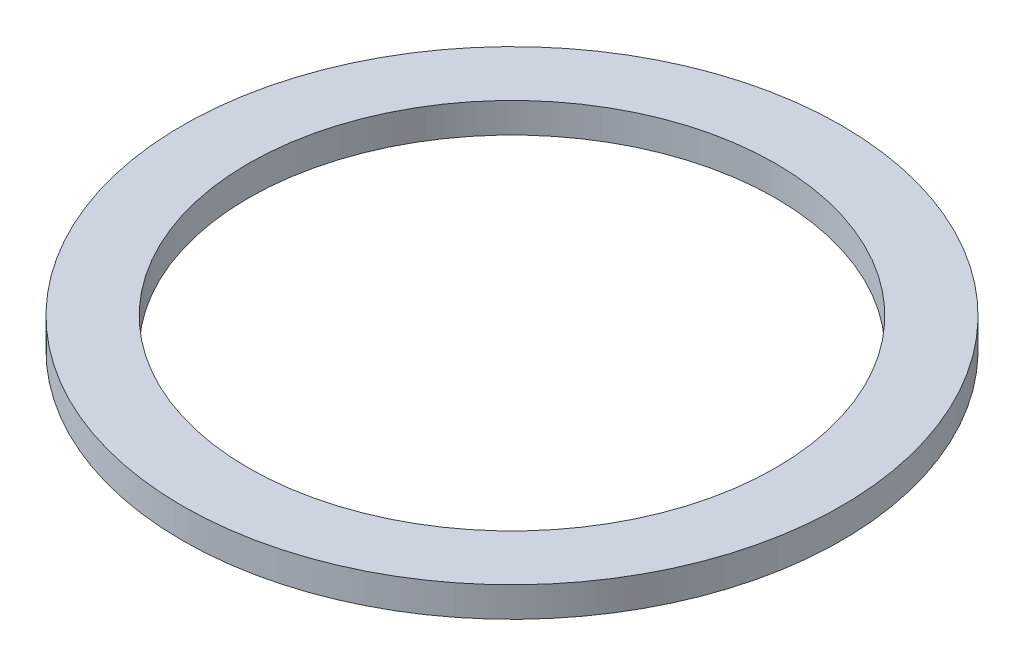
from build123d import *

# Parameters (mm, degrees)
SKETCH1_W = 55
SKETCH1_H = 25


with BuildPart() as part:
    # Sketch1 → Revolve1 (revolve)
    with BuildSketch(Plane(origin=(0, 0, 0), x_dir=(0, 0, -1), z_dir=(1, 0, 0))):
        with Locations((-247.5, 0)):
            Rectangle(SKETCH1_W, SKETCH1_H)
    revolve(axis=Axis((0, 166.775456919, 0), (0, -1, 0)))


solid = part.part
